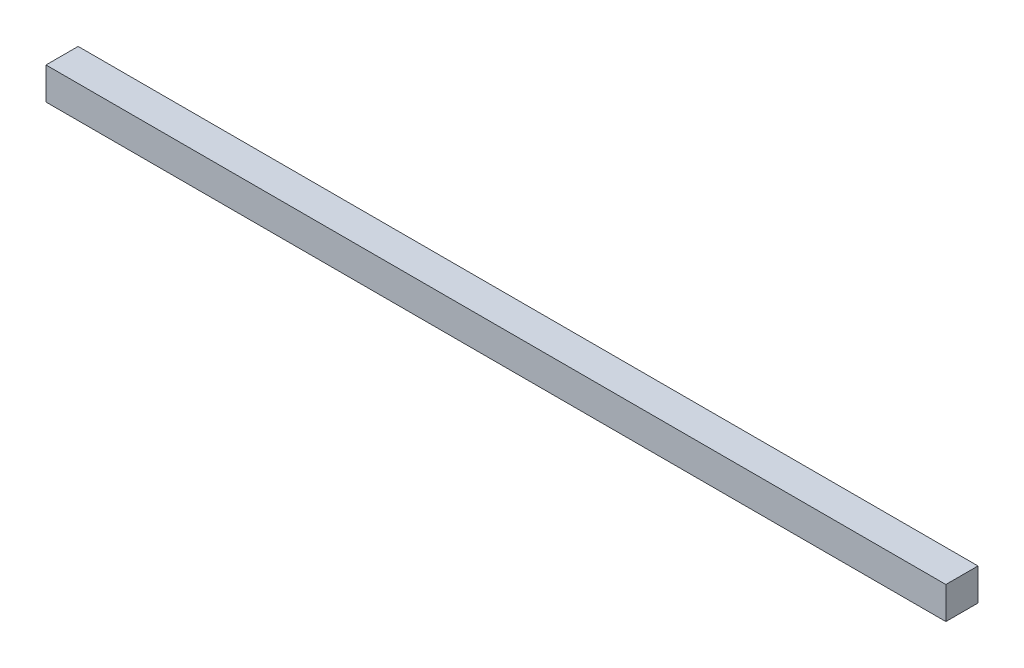
from build123d import *

# Parameters (mm, degrees)
SKETCH_1_W         = 700
SKETCH_1_H         = 25
BLOCKEXTRUDE_DEPTH = 25


with BuildPart() as part:
    # 草图1 → BlockExtrude (new body)
    with BuildSketch(Plane.XY):
        with Locations((350, 12.5)):
            Rectangle(SKETCH_1_W, SKETCH_1_H)
    extrude(amount=BLOCKEXTRUDE_DEPTH)


solid = part.part
